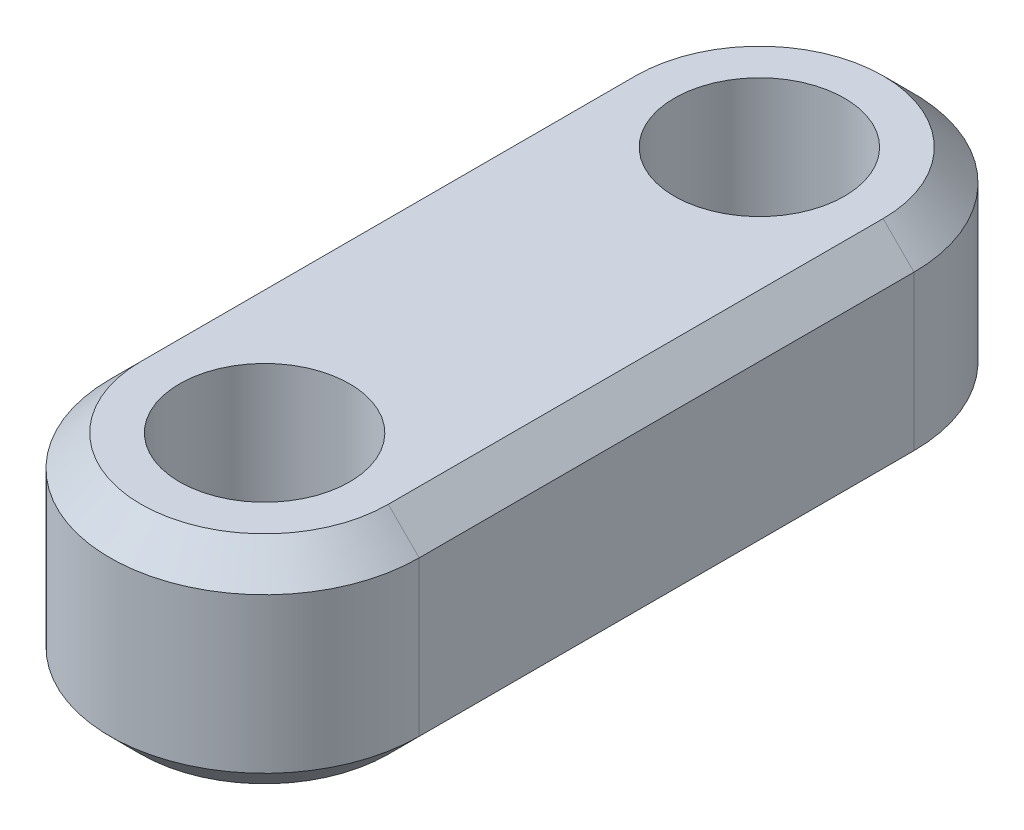
from build123d import *

# Parameters (mm, degrees)
SKETCH_1_R      = 2.75
EXTRUDE_1_DEPTH = 7
CHAMFER_1_SIZE  = 1


with BuildPart() as part:
    # 草图1 → 凸台-拉伸1 (new body)
    with BuildSketch(Plane(origin=(0, 0, 0), x_dir=(1, 0, 0), z_dir=(0, 1, 0))):
        with BuildLine():
            Line((-5, -16), (-5, 0))
            ThreePointArc((-5, 0), (0, 5), (5, 0))
            Line((5, 0), (5, -16))
            ThreePointArc((5, -16), (0, -21), (-5, -16))
        make_face()
        with Locations(Location((0, 0, 0), (0, 0, 270))):
            Circle(SKETCH_1_R, mode=Mode.SUBTRACT)
        with Locations(Location((0, -16, 0), (0, 0, 270))):
            Circle(SKETCH_1_R, mode=Mode.SUBTRACT)
    extrude(amount=EXTRUDE_1_DEPTH)

    # 倒角1
    chamfer_1_edges = [part.edges().sort_by_distance(p)[0] for p in [
        (0, 7, -5),
        (-5, 7, 8),
        (0, 7, 21),
        (-5, 0, 8),
        (0, 0, -5),
        (5, 0, 8),
        (0, 0, 21),
        (5, 7, 8),
    ]]
    chamfer(chamfer_1_edges, length=CHAMFER_1_SIZE)


solid = part.part
